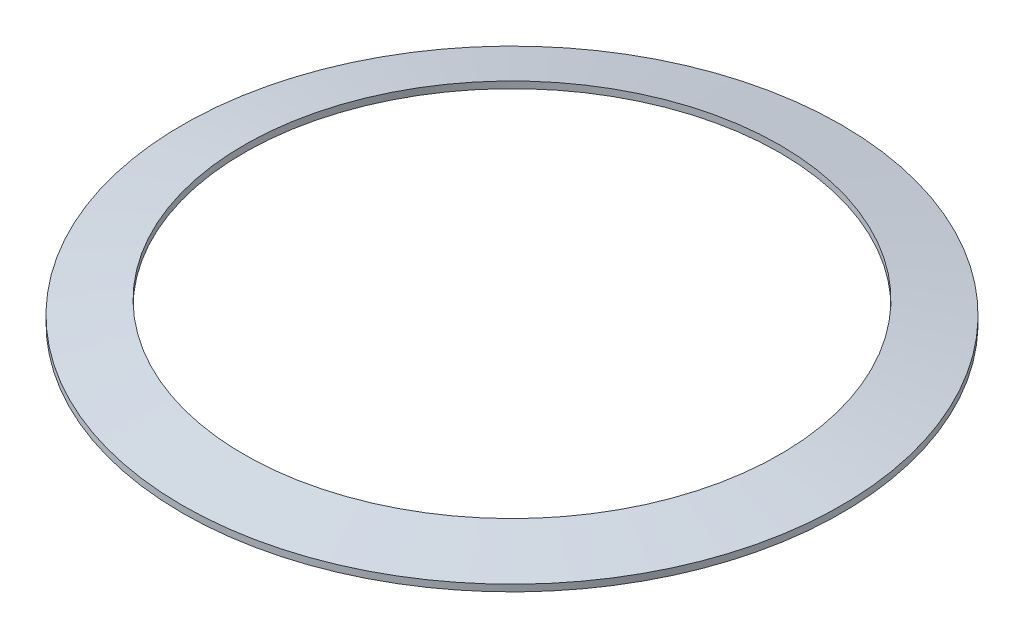
from build123d import *


with BuildPart() as part:
    # Esboço1 → Revolução1 (revolve)
    with BuildSketch(Plane.XY, mode=Mode.PRIVATE) as revolu_o1_sk:
        Polygon((49.5, 0), (49.5, 1), (40.25, 3), (40.25, 2), align=None)
    revolve(revolu_o1_sk.sketch.rotate(Axis((0, -4.822222222, 0), (0, 1, 0)), 90), axis=Axis((0, -4.822222222, 0), (0, 1, 0)))


solid = part.part
